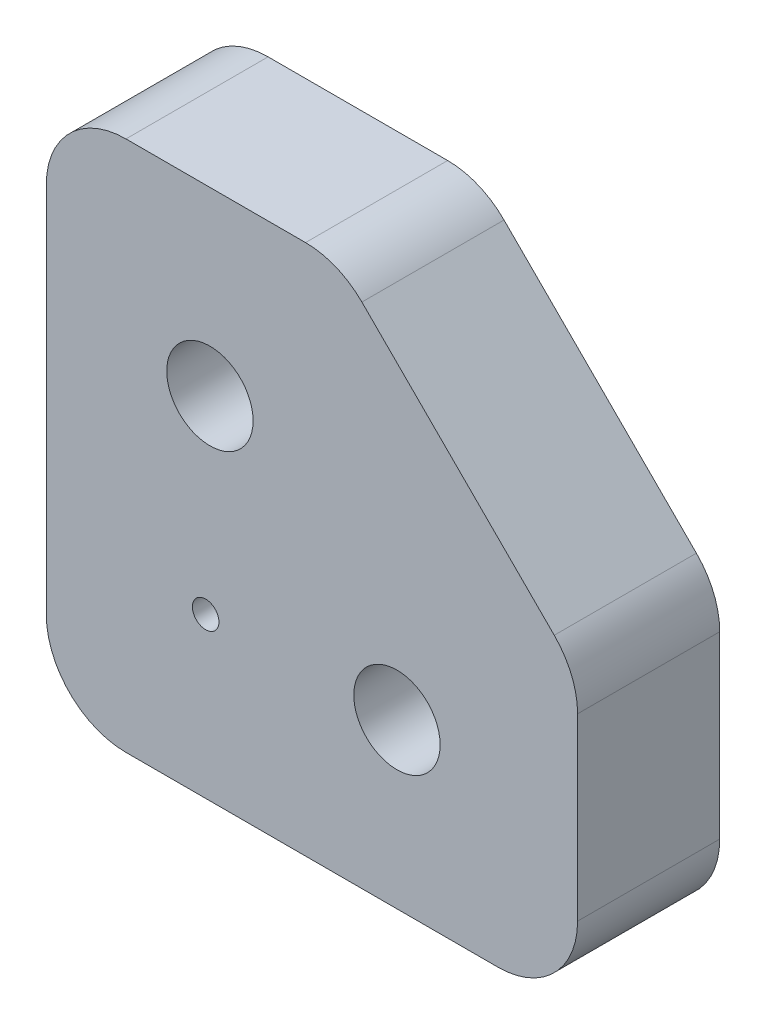
from build123d import *

# Parameters (mm, degrees)
MODEL_R             = 1.625
MODEL_R_2           = 0.5
BOSS_EXTRUDE1_DEPTH = 5.35


with BuildPart() as part:
    # Model → Boss-Extrude1 (new body)
    with BuildSketch(Plane.XY):
        with BuildLine():
            Line((1.880546904, 19.121320344), (9.121320344, 11.880546904))
            ThreePointArc((9.121320344, 11.880546904), (9.771638598, 10.907276858), (10, 9.759226561))
            Line((10, 9.759226561), (10, 3))
            ThreePointArc((10, 3), (9.121320344, 0.878679656), (7, 0))
            Line((7, 0), (-7, 0))
            ThreePointArc((-7, 0), (-9.121320344, 0.878679656), (-10, 3))
            Line((-10, 3), (-10, 17))
            ThreePointArc((-10, 17), (-9.121320344, 19.121320344), (-7, 20))
            Line((-7, 20), (-0.240773439, 20))
            ThreePointArc((-0.240773439, 20), (0.907276858, 19.771638598), (1.880546904, 19.121320344))
        make_face()
        with Locations((3.2, 6.16)):
            Circle(MODEL_R, mode=Mode.SUBTRACT)
        with Locations((-3.84, 13.2)):
            Circle(MODEL_R, mode=Mode.SUBTRACT)
        with Locations((-4, 6)):
            Circle(MODEL_R_2, mode=Mode.SUBTRACT)
    extrude(amount=BOSS_EXTRUDE1_DEPTH)


solid = part.part
